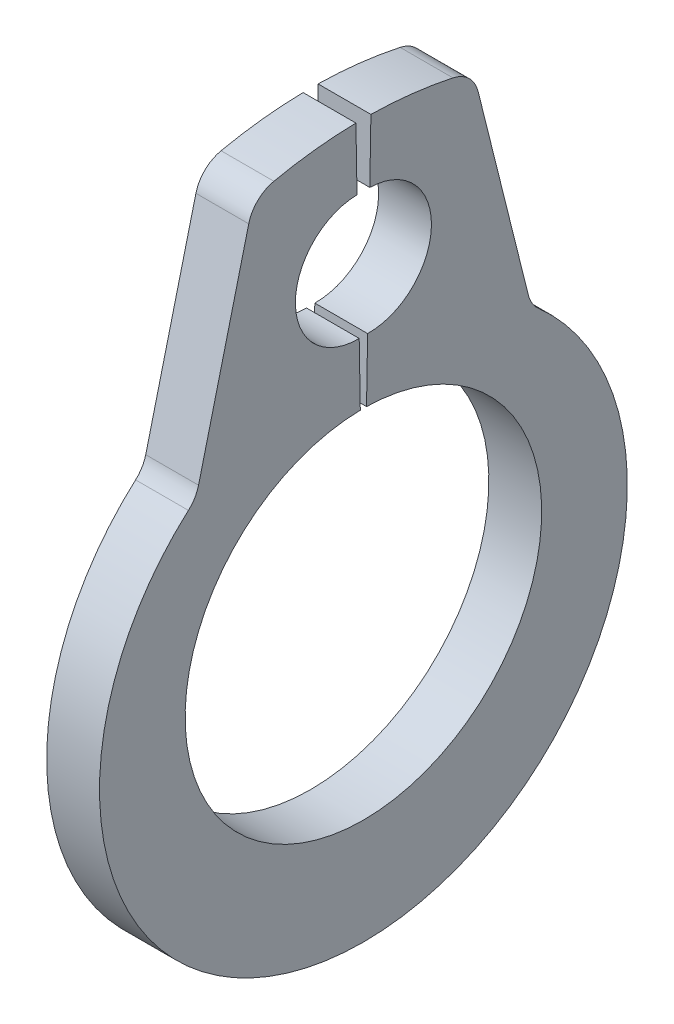
from build123d import *

# Parameters (mm, degrees)
EXTRUDE1_DEPTH = 0.2
FILLET1_R      = 0.25


with BuildPart() as part:
    # Sketch1 → Extrude1 (new, symmetric)
    with BuildSketch(Plane(origin=(0, 0, 0), x_dir=(0, 0, -1), z_dir=(1, 0, 0))):
        with BuildLine():
            Line((0.023560749, 1.349794388), (0.031850642, 1.824722044))
            ThreePointArc((0.031850642, 1.824722044), (0.51506819, 2.291359806), (0.048430428, 2.774577354))
            Line((0.048430428, 2.774577354), (0.056720321, 3.249505009))
            ThreePointArc((0.056720321, 3.249505009), (0.447409805, 3.219056456), (0.831594516, 3.141806894))
            Line((0.831594516, 3.141806894), (1.267663611, 1.392829284))
            ThreePointArc((1.267663611, 1.392829284), (0, -2.15), (-1.267663611, 1.392829284))
            Line((-1.267663611, 1.392829284), (-0.831594516, 3.141806894))
            ThreePointArc((-0.831594516, 3.141806894), (-0.447409805, 3.219056456), (-0.056720321, 3.249505009))
            Line((-0.056720321, 3.249505009), (-0.048430428, 2.774577354))
            ThreePointArc((-0.048430428, 2.774577354), (-0.51506819, 2.291359806), (-0.031850642, 1.824722044))
            Line((-0.031850642, 1.824722044), (-0.023560749, 1.349794388))
            ThreePointArc((-0.023560749, 1.349794388), (0, -1.35), (0.023560749, 1.349794388))
        make_face()
    extrude(amount=EXTRUDE1_DEPTH, both=True)

    # Fillet1
    fillet1_edges = [part.edges().sort_by_distance(p)[0] for p in [
        (0, 3.141806894, -0.831594516),
        (0, 1.392829284, -1.267663611),
        (0, 1.392829284, 1.267663611),
        (0, 3.141806894, 0.831594516),
    ]]
    fillet(fillet1_edges, radius=FILLET1_R)


solid = part.part
